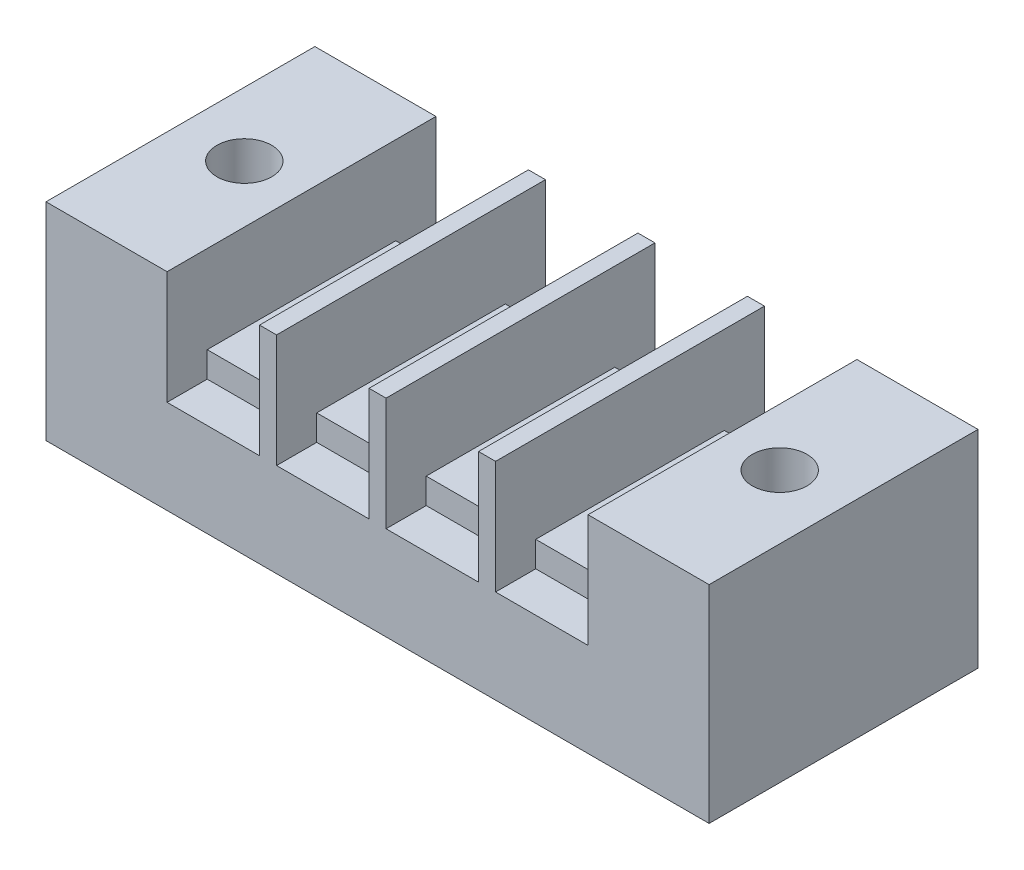
from build123d import *

# Parameters (mm, degrees)
SKETCH_1_W               = 54.5
SKETCH_1_H               = 22.1
SKETCH_1_R               = 2.25
EXTRUDE_1_DEPTH          = 17
SKETCH_2_W               = 7.6
SKETCH_2_H               = 22.1
CUT_EXTRUDE_1_DEPTH      = 7.2
SKETCH_3_W               = 7.6
SKETCH_3_H               = 3.3
CUT_EXTRUDE_2_DEPTH      = 2.1
MIRROR_2_COPY_1_SKETCH_W = 7.6
MIRROR_2_COPY_1_SKETCH_H = 3.3
MIRROR_2_COPY_1_DEPTH    = 2.1
SKETCH_4_R               = 1.75
CUT_EXTRUDE_3_DEPTH      = 5


with BuildPart() as part:
    # ｽｹｯﾁ1 → ﾎﾞｽ - 押し出し1 (new body)
    with BuildSketch(Plane(origin=(0, 0, 0), x_dir=(1, 0, 0), z_dir=(0, 1, 0))):
        Rectangle(SKETCH_1_W, SKETCH_1_H)
        with Locations(Location((-22, 0, 0), (0, 0, 270))):
            Circle(SKETCH_1_R, mode=Mode.SUBTRACT)
        with Locations(Location((22, 0, 0), (0, 0, 90))):
            Circle(SKETCH_1_R, mode=Mode.SUBTRACT)
    extrude(amount=EXTRUDE_1_DEPTH)

    # ｽｹｯﾁ2 → ｶｯﾄ - 押し出し1 (cut)
    with BuildSketch(Plane(origin=(0, 17, 0), x_dir=(1, 0, 0), z_dir=(0, 1, 0))):
        with Locations((13.5, 0)):
            Rectangle(SKETCH_2_W, SKETCH_2_H)
        with Locations((-13.5, 0)):
            Rectangle(SKETCH_2_W, SKETCH_2_H)
        with Locations((-4.5, 0)):
            Rectangle(SKETCH_2_W, SKETCH_2_H)
        with Locations((4.5, 0)):
            Rectangle(SKETCH_2_W, SKETCH_2_H)
    extrude(amount=-CUT_EXTRUDE_1_DEPTH, mode=Mode.SUBTRACT)

    # ｽｹｯﾁ3 → ｶｯﾄ - 押し出し2 (cut)
    with BuildSketch(Plane(origin=(0, 9.8, 0), x_dir=(1, 0, 0), z_dir=(0, 1, 0))):
        with Locations((4.5, 9.4)):
            Rectangle(SKETCH_3_W, SKETCH_3_H)
        with Locations((13.5, 9.4)):
            Rectangle(SKETCH_3_W, SKETCH_3_H)
    cut_extrude_2 = extrude(amount=-CUT_EXTRUDE_2_DEPTH, mode=Mode.SUBTRACT)

    # ﾐﾗｰ1: ｶｯﾄ - 押し出し2 across plane
    add(cut_extrude_2.mirror(Plane(origin=(0, 0, 0), x_dir=(0, 0, 1), z_dir=(1, 0, 0))), mode=Mode.SUBTRACT)

    # ﾐﾗｰ2: ｶｯﾄ - 押し出し2 across plane
    add(cut_extrude_2.mirror(Plane.XY), mode=Mode.SUBTRACT)

    # ﾐﾗｰ2 copy 1 sketch → ﾐﾗｰ2 copy 1 (cut)
    with BuildSketch(Plane(origin=(0, 9.8, 0), x_dir=(-1, 0, 0), z_dir=(0, 1, 0))):
        with Locations((4.5, 9.4)):
            Rectangle(MIRROR_2_COPY_1_SKETCH_W, MIRROR_2_COPY_1_SKETCH_H)
        with Locations((13.5, 9.4)):
            Rectangle(MIRROR_2_COPY_1_SKETCH_W, MIRROR_2_COPY_1_SKETCH_H)
    extrude(amount=-MIRROR_2_COPY_1_DEPTH, mode=Mode.SUBTRACT)

    # ｽｹｯﾁ4 → ｶｯﾄ - 押し出し3 (cut)
    with BuildSketch(Plane(origin=(0, 9.8, 0), x_dir=(1, 0, 0), z_dir=(0, 1, 0))):
        with Locations(Location((13.5, 4, 0), (0, 0, 270))):
            Circle(SKETCH_4_R)
        with Locations(Location((4.5, 4, 0), (0, 0, 270))):
            Circle(SKETCH_4_R)
        with Locations(Location((-4.5, 4, 0), (0, 0, 270))):
            Circle(SKETCH_4_R)
        with Locations(Location((-13.5, 4, 0), (0, 0, 270))):
            Circle(SKETCH_4_R)
        with Locations(Location((13.5, -4, 0), (0, 0, 90))):
            Circle(SKETCH_4_R)
        with Locations(Location((4.5, -4, 0), (0, 0, 90))):
            Circle(SKETCH_4_R)
        with Locations(Location((-4.5, -4, 0), (0, 0, 90))):
            Circle(SKETCH_4_R)
        with Locations(Location((-13.5, -4, 0), (0, 0, 90))):
            Circle(SKETCH_4_R)
    extrude(amount=-CUT_EXTRUDE_3_DEPTH, mode=Mode.SUBTRACT)


solid = part.part
